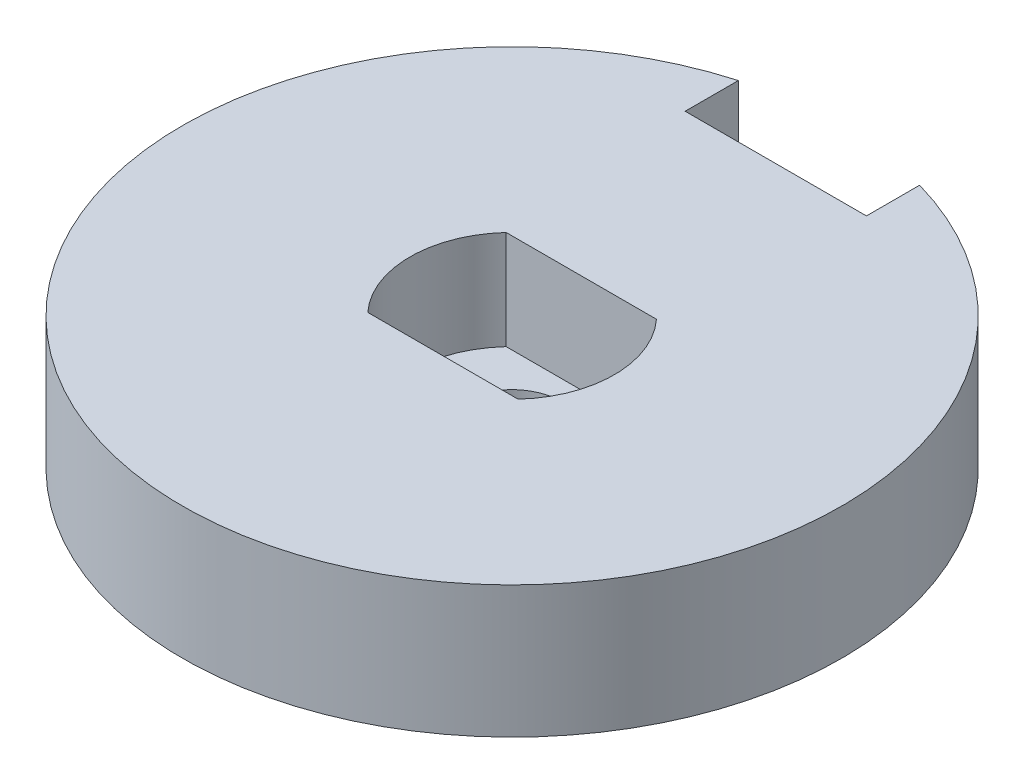
from build123d import *

# Parameters (mm, degrees)
EXTRUDE_1_DEPTH     = 3.5
EXTRUDE_2_DEPTH     = 4
SKETCH_4_R          = 1.5
CUT_EXTRUDE_1_DEPTH = 4
CUT_EXTRUDE_2_DEPTH = 3
SKETCH_6_R          = 1.5
CUT_EXTRUDE_3_DEPTH = 17.007810594
SKETCH_7_W          = 4
SKETCH_7_H          = 4.5
CUT_EXTRUDE_4_DEPTH = 0.9
SKETCH_8_W          = 4
SKETCH_8_H          = 4.5
EXTRUDE_3_DEPTH     = 0.9


with BuildPart() as part:
    # 草图1 → 凸台-拉伸1 (new body)
    with BuildSketch(Plane(origin=(0, 0, 0), x_dir=(1, 0, 0), z_dir=(0, 1, 0))):
        Polygon((2.370649369, -2.525870458), (3.372792668, 0.790107348), (1.002143299, 3.315977806), (-2.370649369, 2.525870458), (-3.372792668, -0.790107348), (-1.002143299, -3.315977806), align=None)
    extrude(amount=EXTRUDE_1_DEPTH)

    # 草图3 → 凸台-拉伸2 (add)
    with BuildSketch(Plane(origin=(0, 3.5, 0), x_dir=(1, 0, 0), z_dir=(0, 1, 0))):
        with BuildLine():
            Line((-2.75, 8), (2.75, 8))
            Line((2.75, 8), (2.75, 9.614442262))
            ThreePointArc((2.75, 9.614442262), (0, -10), (-2.75, 9.614442262))
            Line((-2.75, 9.614442262), (-2.75, 8))
        make_face()
    extrude(amount=EXTRUDE_2_DEPTH)

    # 草图4 → 切除-拉伸1 (cut)
    with BuildSketch(Plane.XZ):
        with Locations(Location((0, 0, 0), (0, 0, 270))):
            Circle(SKETCH_4_R)
    extrude(amount=-CUT_EXTRUDE_1_DEPTH, mode=Mode.SUBTRACT)

    # 草图5 → 切除-拉伸2 (cut)
    with BuildSketch(Plane(origin=(0, 7.5, 0), x_dir=(1, 0, 0), z_dir=(0, 1, 0))):
        with BuildLine():
            Line((-2.28035085, 2.1), (2.28035085, 2.1))
            ThreePointArc((2.28035085, 2.1), (3.1, 0), (2.28035085, -2.1))
            Line((2.28035085, -2.1), (-2.28035085, -2.1))
            ThreePointArc((-2.28035085, -2.1), (-3.1, 0), (-2.28035085, 2.1))
        make_face()
    extrude(amount=-CUT_EXTRUDE_2_DEPTH, mode=Mode.SUBTRACT)

    # 草图6 → 切除-拉伸3 (cut, through all)
    with BuildSketch(Plane.XZ):
        with Locations(Location((0, 0, 0), (0, 0, 270))):
            Circle(SKETCH_6_R)
    extrude(amount=-CUT_EXTRUDE_3_DEPTH, mode=Mode.SUBTRACT)

    # 草图7 → 切除-拉伸4 (cut)
    with BuildSketch(Plane(origin=(0, 7.5, 0), x_dir=(1, 0, 0), z_dir=(0, 1, 0))):
        with Locations((0, 5.75)):
            Rectangle(SKETCH_7_W, SKETCH_7_H)
    cut_extrude_4 = extrude(amount=-CUT_EXTRUDE_4_DEPTH, mode=Mode.SUBTRACT)

    # 镜向1: 切除-拉伸4 across plane
    add(cut_extrude_4.mirror(Plane.ZX.offset(5.5)), mode=Mode.SUBTRACT)

    # 草图8 → 凸台-拉伸3 (add)
    with BuildSketch(Plane(origin=(0, 6.6, 0), x_dir=(1, 0, 0), z_dir=(0, 1, 0))):
        with Locations((0, 5.75)):
            Rectangle(SKETCH_8_W, SKETCH_8_H)
    extrude(amount=EXTRUDE_3_DEPTH)


solid = part.part
